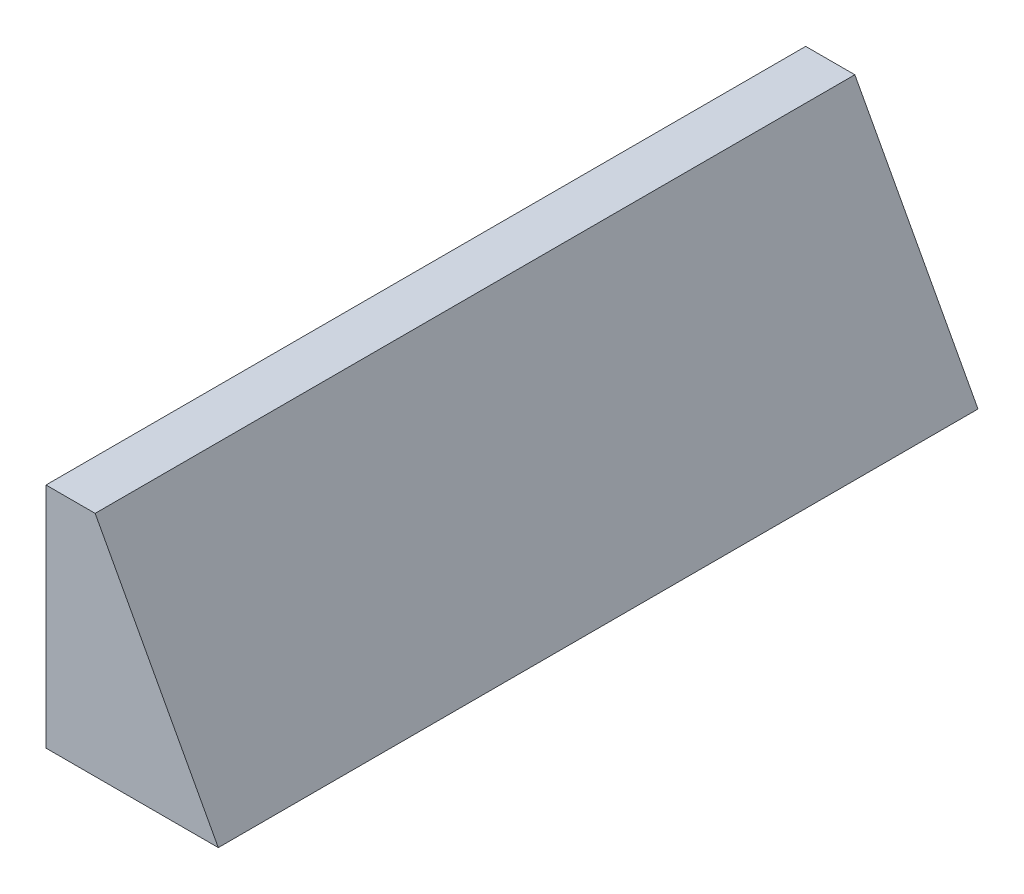
from build123d import *

# Parameters (mm, degrees)
BOSS_EXTRUDE1_DEPTH = 50


with BuildPart() as part:
    # Sketch1 → Boss-Extrude1 (new body)
    with BuildSketch(Plane.XY):
        Polygon((0, 15), (0, 0), (11.34, 0), (3.234299287, 15), align=None)
    extrude(amount=BOSS_EXTRUDE1_DEPTH)


solid = part.part
